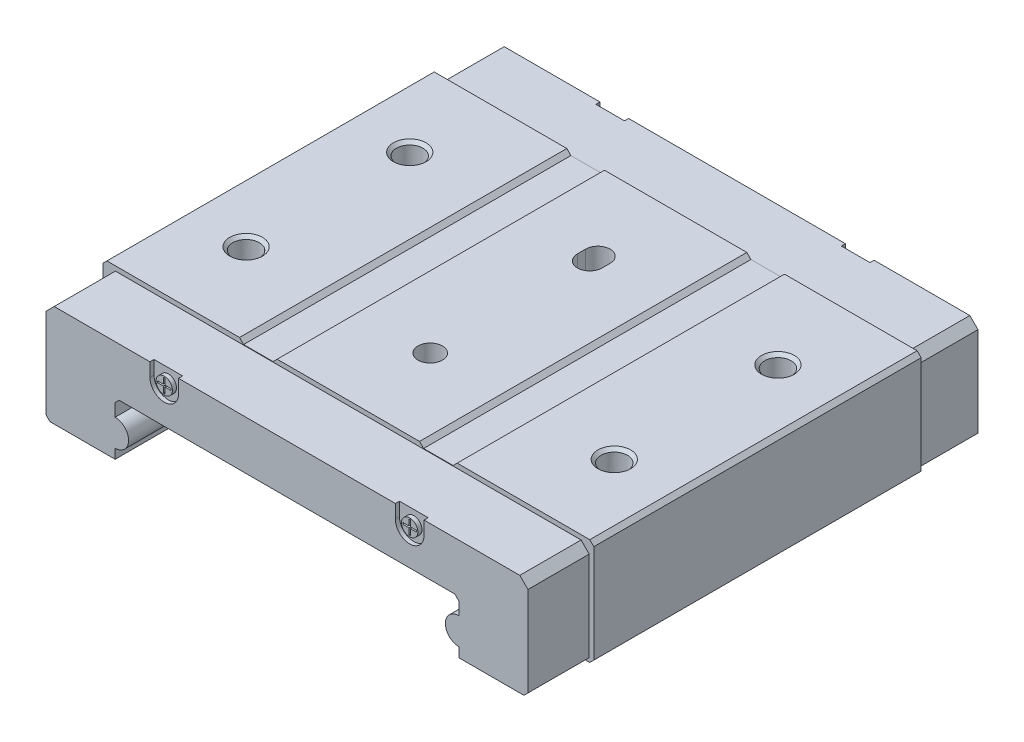
from build123d import *

# Parameters (mm, degrees)
BOSS_EXTRUDE1_DEPTH      = 20
BOSS_EXTRUDE1_DEPTH_BACK = 20
BOSS_EXTRUDE2_DEPTH      = 7.5
BOSS_EXTRUDE2_DEPTH_BACK = 7.5
SKETCH3_W                = 80
SKETCH3_H                = 80
CUT_EXTRUDE1_DEPTH       = 0.02
BOSS_EXTRUDE3_DEPTH      = 7.5
BOSS_EXTRUDE3_DEPTH_BACK = 7.5
CUT_EXTRUDE2_START       = -0.02
SKETCH5_W                = 80
SKETCH5_H                = 80
CUT_EXTRUDE2_DEPTH       = 0.02
CUT_EXTRUDE3_DEPTH       = 0.5
CUT_EXTRUDE3_DEPTH_BACK  = 0.5
CUT_EXTRUDE4_START       = -0.5
CUT_EXTRUDE4_DEPTH       = 0.5
SKETCH8_R                = 1
BOSS_EXTRUDE4_DEPTH      = 0.5
SKETCH9_R                = 1
BOSS_EXTRUDE5_DEPTH      = 0.5
BOSS_EXTRUDE6_START      = -0.5
SKETCH10_R               = 1
BOSS_EXTRUDE6_DEPTH      = 0.5
BOSS_EXTRUDE7_START      = -0.5
SKETCH11_R               = 1
BOSS_EXTRUDE7_DEPTH      = 0.5
SKETCH16_W               = 1.5
SKETCH16_H               = 4
CUT_EXTRUDE5_DEPTH       = 4


with BuildPart() as part:
    # Sketch1 → Boss-Extrude1 (new, two sides: drawn at the far end of the back side and taken through both)
    with BuildSketch(Plane.XY.offset(-BOSS_EXTRUDE1_DEPTH_BACK)):
        with BuildLine():
            Line((-30, 12.505025253), (-30, 0.494974747))
            Line((-30, 0.494974747), (-29.505025253, 0))
            Line((-29.505025253, 0), (-21, 0))
            Line((-21, 0), (-21, 1.176))
            ThreePointArc((-21, 1.176), (-19.36, 2.816), (-21, 4.456))
            Line((-21, 4.456), (-21, 6.005025253))
            Line((-21, 6.005025253), (-20.505025253, 6.5))
            Line((-20.505025253, 6.5), (20.505025253, 6.5))
            Line((20.505025253, 6.5), (21, 6.005025253))
            Line((21, 6.005025253), (21, 4.456))
            ThreePointArc((21, 4.456), (19.36, 2.816), (21, 1.176))
            Line((21, 1.176), (21, 0))
            Line((21, 0), (29.505025253, 0))
            Line((29.505025253, 0), (30, 0.494974747))
            Line((30, 0.494974747), (30, 12.505025253))
            Line((30, 12.505025253), (29.505025253, 13))
            Line((29.505025253, 13), (13.3, 13))
            Line((13.3, 13), (12.8, 12.5))
            Line((12.8, 12.5), (9.2, 12.5))
            Line((9.2, 12.5), (8.7, 13))
            Line((8.7, 13), (-8.7, 13))
            Line((-8.7, 13), (-9.2, 12.5))
            Line((-9.2, 12.5), (-12.8, 12.5))
            Line((-12.8, 12.5), (-13.3, 13))
            Line((-13.3, 13), (-29.505025253, 13))
            Line((-29.505025253, 13), (-30, 12.505025253))
        make_face()
    extrude(amount=BOSS_EXTRUDE1_DEPTH + BOSS_EXTRUDE1_DEPTH_BACK)

    # Sketch2 → Boss-Extrude2 (add, two sides: drawn at the far end of the back side and taken through both)
    with BuildSketch(Plane.XY.offset(20).offset(-BOSS_EXTRUDE2_DEPTH_BACK)):
        with BuildLine():
            Line((-29.45, 11.452979439), (-29.45, 0.494974747))
            Line((-29.45, 0.494974747), (-28.955025253, 0))
            Line((-28.955025253, 0), (-21, 0))
            Line((-21, 0), (-21, 1.176))
            ThreePointArc((-21, 1.176), (-19.36, 2.816), (-21, 4.456))
            Line((-21, 4.456), (-21, 6.005025253))
            Line((-21, 6.005025253), (-20.505025253, 6.5))
            Line((-20.505025253, 6.5), (20.505025253, 6.5))
            Line((20.505025253, 6.5), (21, 6.005025253))
            Line((21, 6.005025253), (21, 4.456))
            ThreePointArc((21, 4.456), (19.36, 2.816), (21, 1.176))
            Line((21, 1.176), (21, 0))
            Line((21, 0), (28.955025253, 0))
            Line((28.955025253, 0), (29.45, 0.494974747))
            Line((29.45, 0.494974747), (29.45, 11.452979439))
            Line((29.45, 11.452979439), (28.452979439, 12.45))
            Line((28.452979439, 12.45), (-28.452979439, 12.45))
            Line((-28.452979439, 12.45), (-29.45, 11.452979439))
        make_face()
    extrude(amount=BOSS_EXTRUDE2_DEPTH + BOSS_EXTRUDE2_DEPTH_BACK)

    # Sketch3 → Cut-Extrude1 (cut)
    with BuildSketch(Plane.XY.offset(20)):
        Rectangle(SKETCH3_W, SKETCH3_H)
        with BuildLine():
            Line((-29.44, 11.442979439), (-29.44, 0.504974747))
            Line((-29.44, 0.504974747), (-28.945025253, 0.01))
            Line((-28.945025253, 0.01), (-21.01, 0.01))
            Line((-21.01, 0.01), (-21.01, 1.206))
            ThreePointArc((-21.01, 1.206), (-19.39, 2.826), (-21.01, 4.446))
            Line((-21.01, 4.446), (-21.01, 6.51))
            Line((-21.01, 6.51), (21.01, 6.51))
            Line((21.01, 6.51), (21.01, 4.446))
            ThreePointArc((21.01, 4.446), (19.39, 2.826), (21.01, 1.206))
            Line((21.01, 1.206), (21.01, 0.01))
            Line((21.01, 0.01), (28.945025253, 0.01))
            Line((28.945025253, 0.01), (29.44, 0.504974747))
            Line((29.44, 0.504974747), (29.44, 11.442979439))
            Line((29.44, 11.442979439), (28.442979439, 12.44))
            Line((28.442979439, 12.44), (-28.442979439, 12.44))
            Line((-28.442979439, 12.44), (-29.44, 11.442979439))
        make_face(mode=Mode.SUBTRACT)
    extrude(amount=CUT_EXTRUDE1_DEPTH, mode=Mode.SUBTRACT)

    # Sketch4 → Boss-Extrude3 (add, two sides: drawn at the far end of the back side and taken through both)
    with BuildSketch(Plane.XY.offset(-20).offset(-BOSS_EXTRUDE3_DEPTH_BACK)):
        with BuildLine():
            Line((-29.45, 11.452979439), (-29.45, 0.494974747))
            Line((-29.45, 0.494974747), (-28.955025253, 0))
            Line((-28.955025253, 0), (-21, 0))
            Line((-21, 0), (-21, 1.176))
            ThreePointArc((-21, 1.176), (-19.36, 2.816), (-21, 4.456))
            Line((-21, 4.456), (-21, 6.005025253))
            Line((-21, 6.005025253), (-20.505025253, 6.5))
            Line((-20.505025253, 6.5), (20.505025253, 6.5))
            Line((20.505025253, 6.5), (21, 6.005025253))
            Line((21, 6.005025253), (21, 4.456))
            ThreePointArc((21, 4.456), (19.36, 2.816), (21, 1.176))
            Line((21, 1.176), (21, 0))
            Line((21, 0), (28.955025253, 0))
            Line((28.955025253, 0), (29.45, 0.494974747))
            Line((29.45, 0.494974747), (29.45, 11.452979439))
            Line((29.45, 11.452979439), (28.452979439, 12.45))
            Line((28.452979439, 12.45), (-28.452979439, 12.45))
            Line((-28.452979439, 12.45), (-29.45, 11.452979439))
        make_face()
    extrude(amount=BOSS_EXTRUDE3_DEPTH + BOSS_EXTRUDE3_DEPTH_BACK)

    # Sketch5 → Cut-Extrude2 (cut)
    with BuildSketch(Plane.XY.offset(-20).offset(CUT_EXTRUDE2_START)):
        Rectangle(SKETCH5_W, SKETCH5_H)
        with BuildLine():
            Line((-29.44, 11.442979439), (-29.44, 0.504974747))
            Line((-29.44, 0.504974747), (-28.945025253, 0.01))
            Line((-28.945025253, 0.01), (-21.01, 0.01))
            Line((-21.01, 0.01), (-21.01, 1.206))
            ThreePointArc((-21.01, 1.206), (-19.39, 2.826), (-21.01, 4.446))
            Line((-21.01, 4.446), (-21.01, 6.51))
            Line((-21.01, 6.51), (21.01, 6.51))
            Line((21.01, 6.51), (21.01, 4.446))
            ThreePointArc((21.01, 4.446), (19.39, 2.826), (21.01, 1.206))
            Line((21.01, 1.206), (21.01, 0.01))
            Line((21.01, 0.01), (28.945025253, 0.01))
            Line((28.945025253, 0.01), (29.44, 0.504974747))
            Line((29.44, 0.504974747), (29.44, 11.442979439))
            Line((29.44, 11.442979439), (28.442979439, 12.44))
            Line((28.442979439, 12.44), (-28.442979439, 12.44))
            Line((-28.442979439, 12.44), (-29.44, 11.442979439))
        make_face(mode=Mode.SUBTRACT)
    extrude(amount=CUT_EXTRUDE2_DEPTH, mode=Mode.SUBTRACT)

    # Sketch6 → Cut-Extrude3 (cut, two sides: drawn at the far end of the back side and taken through both)
    with BuildSketch(Plane.XY.offset(-27.5).offset(-CUT_EXTRUDE3_DEPTH_BACK)):
        with BuildLine():
            Line((-16.75, 32), (-16.75, 10.8))
            ThreePointArc((-16.75, 10.8), (-15, 9.05), (-13.25, 10.8))
            Line((-13.25, 10.8), (-13.25, 30.82500207))
            Line((-13.25, 30.82500207), (13.25, 30.82500207))
            Line((13.25, 30.82500207), (13.25, 10.8))
            ThreePointArc((13.25, 10.8), (15, 9.05), (16.75, 10.8))
            Line((16.75, 10.8), (16.75, 32))
            Line((16.75, 32), (-16.75, 32))
        make_face()
    extrude(amount=CUT_EXTRUDE3_DEPTH + CUT_EXTRUDE3_DEPTH_BACK, mode=Mode.SUBTRACT)

    # Sketch7 → Cut-Extrude4 (cut)
    with BuildSketch(Plane.XY.offset(27.5).offset(CUT_EXTRUDE4_START)):
        with BuildLine():
            Line((-16.75, 32), (-16.75, 10.8))
            ThreePointArc((-16.75, 10.8), (-15, 9.05), (-13.25, 10.8))
            Line((-13.25, 10.8), (-13.25, 30.82500207))
            Line((-13.25, 30.82500207), (13.25, 30.82500207))
            Line((13.25, 30.82500207), (13.25, 10.8))
            ThreePointArc((13.25, 10.8), (15, 9.05), (16.75, 10.8))
            Line((16.75, 10.8), (16.75, 32))
            Line((16.75, 32), (-16.75, 32))
        make_face()
    extrude(amount=CUT_EXTRUDE4_DEPTH, mode=Mode.SUBTRACT)

    # Sketch8 → Boss-Extrude4 (add)
    with BuildSketch(Plane.XY.offset(-27.5)):
        with Locations((-15, 10.8)):
            Circle(SKETCH8_R)
        Polygon((-15.85, 10.9), (-15.85, 10.7), (-15.1, 10.7), (-15.1, 9.95), (-14.9, 9.95), (-14.9, 10.7), (-14.15, 10.7), (-14.15, 10.9), (-14.9, 10.9), (-14.9, 11.65), (-15.1, 11.65), (-15.1, 10.9), align=None, mode=Mode.SUBTRACT)
    extrude(amount=BOSS_EXTRUDE4_DEPTH)

    # Sketch9 → Boss-Extrude5 (add)
    with BuildSketch(Plane.XY.offset(-27.5)):
        with Locations((15, 10.8)):
            Circle(SKETCH9_R)
        Polygon((14.15, 10.9), (14.15, 10.7), (14.9, 10.7), (14.9, 9.95), (15.1, 9.95), (15.1, 10.7), (15.85, 10.7), (15.85, 10.9), (15.1, 10.9), (15.1, 11.65), (14.9, 11.65), (14.9, 10.9), align=None, mode=Mode.SUBTRACT)
    extrude(amount=BOSS_EXTRUDE5_DEPTH)

    # Sketch10 → Boss-Extrude6 (add)
    with BuildSketch(Plane.XY.offset(27.5).offset(BOSS_EXTRUDE6_START)):
        with Locations((-15, 10.8)):
            Circle(SKETCH10_R)
        Polygon((-15.85, 10.9), (-15.85, 10.7), (-15.1, 10.7), (-15.1, 9.95), (-14.9, 9.95), (-14.9, 10.7), (-14.15, 10.7), (-14.15, 10.9), (-14.9, 10.9), (-14.9, 11.65), (-15.1, 11.65), (-15.1, 10.9), align=None, mode=Mode.SUBTRACT)
    extrude(amount=BOSS_EXTRUDE6_DEPTH)

    # Sketch11 → Boss-Extrude7 (add)
    with BuildSketch(Plane.XY.offset(27.5).offset(BOSS_EXTRUDE7_START)):
        with Locations((15, 10.8)):
            Circle(SKETCH11_R)
        Polygon((14.15, 10.9), (14.15, 10.7), (14.9, 10.7), (14.9, 9.95), (15.1, 9.95), (15.1, 10.7), (15.85, 10.7), (15.85, 10.9), (15.1, 10.9), (15.1, 11.65), (14.9, 11.65), (14.9, 10.9), align=None, mode=Mode.SUBTRACT)
    extrude(amount=BOSS_EXTRUDE7_DEPTH)

    # Sketch12 → Cut-Revolve1 (revolve, cut)
    with BuildSketch(Plane(origin=(22.5, 0, 0), x_dir=(0, 0, -1), z_dir=(1, 0, 0))):
        Polygon((-10, 13), (-8, 13), (-8.379, 12.621), (-8.379, 7.185884786), (-10, 6.25), align=None)
    revolve(axis=Axis((22.5, 6.25, 10), (0, 1, 0)), mode=Mode.SUBTRACT)

    # Sketch13 → Cut-Revolve2 (revolve, cut)
    with BuildSketch(Plane(origin=(-22.5, 0, 0), x_dir=(0, 0, -1), z_dir=(1, 0, 0))):
        Polygon((10, 13), (12, 13), (11.621, 12.621), (11.621, 7.185884786), (10, 6.25), align=None)
    revolve(axis=Axis((-22.5, 6.25, -10), (0, 1, 0)), mode=Mode.SUBTRACT)

    # Sketch14 → Cut-Revolve3 (revolve, cut)
    with BuildSketch(Plane(origin=(22.5, 0, 0), x_dir=(0, 0, -1), z_dir=(1, 0, 0))):
        Polygon((10, 13), (12, 13), (11.621, 12.621), (11.621, 7.185884786), (10, 6.25), align=None)
    revolve(axis=Axis((22.5, 6.25, -10), (0, 1, 0)), mode=Mode.SUBTRACT)

    # Sketch15 → Cut-Revolve4 (revolve, cut)
    with BuildSketch(Plane(origin=(-22.5, 0, 0), x_dir=(0, 0, -1), z_dir=(1, 0, 0))):
        Polygon((-10, 13), (-8, 13), (-8.379, 12.621), (-8.379, 7.185884786), (-10, 6.25), align=None)
    revolve(axis=Axis((-22.5, 6.25, 10), (0, 1, 0)), mode=Mode.SUBTRACT)

    # Sketch16 → Cut-Revolve5 (revolve, cut)
    with BuildSketch(Plane.XY.offset(10)):
        with Locations((0.75, 11)):
            Rectangle(SKETCH16_W, SKETCH16_H)
    revolve(axis=Axis((0, 9, 10), (0, 1, 0)), mode=Mode.SUBTRACT)

    # Sketch17 → Cut-Extrude5 (cut)
    with BuildSketch(Plane(origin=(0, 13, 0), x_dir=(-1, 0, 0), z_dir=(0, 1, 0))):
        with BuildLine():
            Line((1.5, -10.5), (1.5, -9.5))
            ThreePointArc((1.5, -9.5), (0, -8), (-1.5, -9.5))
            Line((-1.5, -9.5), (-1.5, -10.5))
            ThreePointArc((-1.5, -10.5), (0, -12), (1.5, -10.5))
        make_face()
    extrude(amount=-CUT_EXTRUDE5_DEPTH, mode=Mode.SUBTRACT)


solid = part.part
